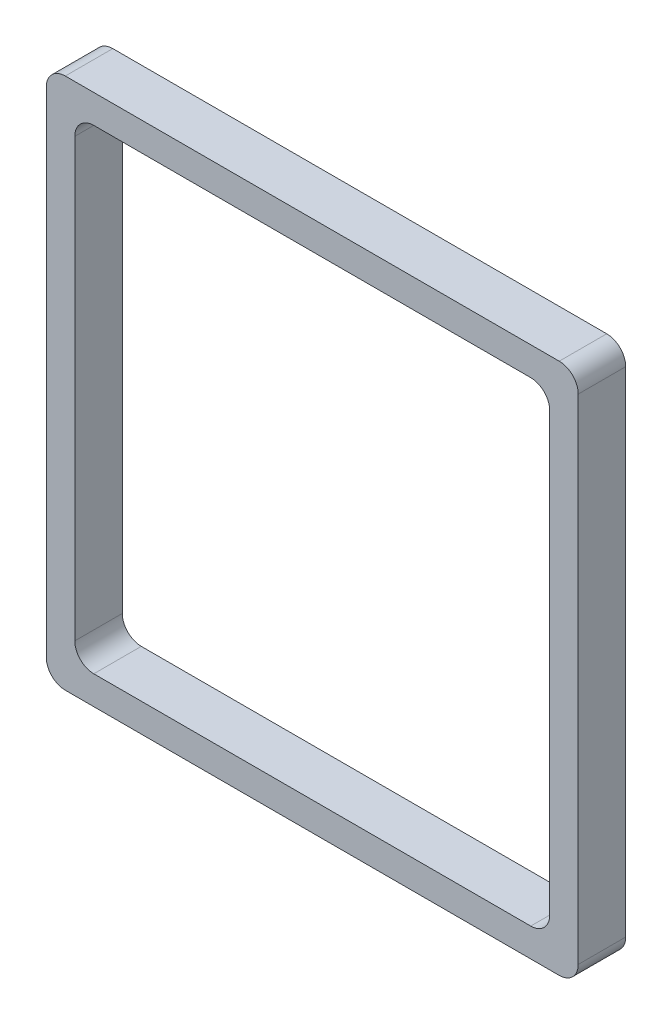
from build123d import *

# Parameters (mm, degrees)
EXTRUDE_1_DEPTH = 5


with BuildPart() as part:
    # Эскиз1 → Бобышка-Вытянуть1 (new body)
    with BuildSketch(Plane.XY):
        with BuildLine():
            Line((26, -28), (-26, -28))
            ThreePointArc((-26, -28), (-27.414213562, -27.414213562), (-28, -26))
            Line((-28, -26), (-28, 26))
            ThreePointArc((-28, 26), (-27.414213562, 27.414213562), (-26, 28))
            Line((-26, 28), (26, 28))
            ThreePointArc((26, 28), (27.414213562, 27.414213562), (28, 26))
            Line((28, 26), (28, -26))
            ThreePointArc((28, -26), (27.414213562, -27.414213562), (26, -28))
        make_face()
        with BuildLine():
            Line((23, -25), (-23, -25))
            ThreePointArc((-23, -25), (-24.414213562, -24.414213562), (-25, -23))
            Line((-25, -23), (-25, 23))
            ThreePointArc((-25, 23), (-24.414213562, 24.414213562), (-23, 25))
            Line((-23, 25), (23, 25))
            ThreePointArc((23, 25), (24.414213562, 24.414213562), (25, 23))
            Line((25, 23), (25, -23))
            ThreePointArc((25, -23), (24.414213562, -24.414213562), (23, -25))
        make_face(mode=Mode.SUBTRACT)
    extrude(amount=EXTRUDE_1_DEPTH)


solid = part.part
